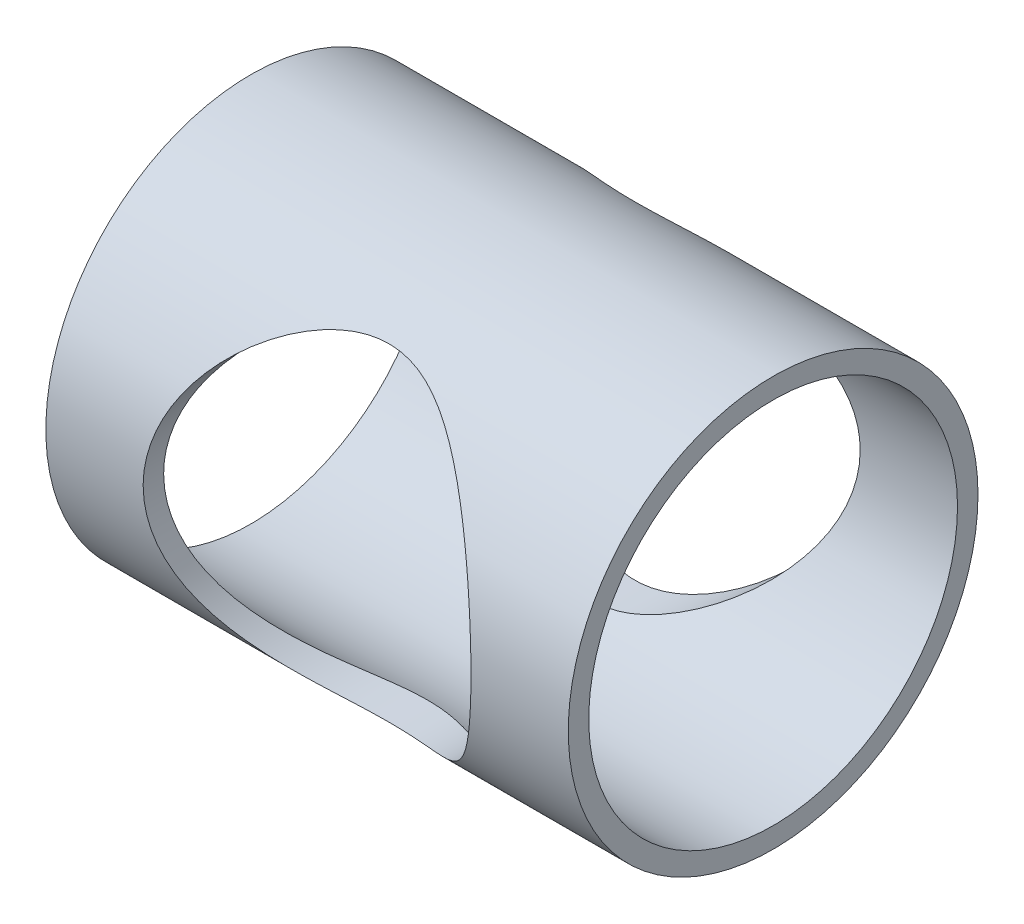
from build123d import *

# Parameters (mm, degrees)
SKETCH1_R               = 31.75
BOSS_EXTRUDE1_DEPTH     = 40.48125
SHELL1_T                = -3.175
CUT_EXTRUDE1_DEPTH      = 61.455410027
CUT_EXTRUDE1_DEPTH_BACK = 61.455410027
SKETCH2_R               = 25.4


with BuildPart() as part:
    # Sketch1 → Boss-Extrude1 (new, symmetric)
    with BuildSketch(Plane(origin=(0, 0, 0), x_dir=(0, 0, -1), z_dir=(1, 0, 0))):
        Circle(SKETCH1_R)
    extrude(amount=BOSS_EXTRUDE1_DEPTH, both=True)

    # Shell1
    shell1_openings = [part.faces().sort_by_distance(p)[0] for p in [
        (40.48125, 0, 0),
        (-40.48125, 0, 0),
    ]]
    offset(amount=SHELL1_T, openings=shell1_openings, kind=Kind.INTERSECTION)

    # Sketch2 → Cut-Extrude1 (cut, two sides: drawn at the far end of the back side and taken through both)
    with BuildSketch(Plane.XY.offset(-CUT_EXTRUDE1_DEPTH_BACK)):
        with Locations(Location((0, 0, 0), (0, 0, 180))):
            Circle(SKETCH2_R)
    extrude(amount=CUT_EXTRUDE1_DEPTH + CUT_EXTRUDE1_DEPTH_BACK, mode=Mode.SUBTRACT)


solid = part.part
